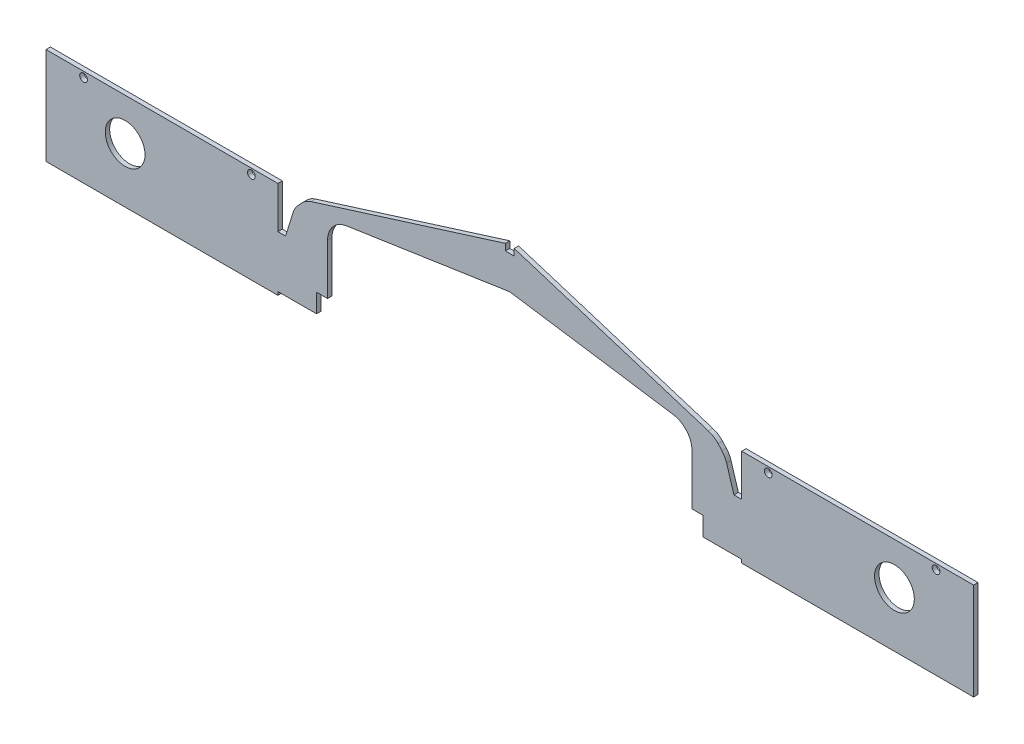
from build123d import *

# Parameters (mm, degrees)
SCHIZZO1_W                   = 420
SCHIZZO1_H                   = 43.9
PIASTRABASE_DEPTH            = 2
SCHIZZO2_R                   = 9
SCHIZZO2_R_2                 = 1.75
FORODESTRO_DEPTH             = 212.153504588
INTAGLIOINFERIORE_DEPTH      = 212.153504588
INTAGLIOSUPERIORE_DEPTH      = 212.153504588
ESTRUSIONE_ESTRUSIONE1_DEPTH = 2
RACCORDO2_R                  = 10
RACCORDO3_R                  = 10
RACCORDO2_OF_SPECCHIA1_R     = 10
RACCORDO3_OF_SPECCHIA1_R     = 10


with BuildPart() as part:
    # Schizzo1 → PiastraBase (new body)
    with BuildSketch(Plane.XY):
        Rectangle(SCHIZZO1_W, SCHIZZO1_H)
    extrude(amount=PIASTRABASE_DEPTH)

    # Schizzo2 → ForoDestro (cut, through all)
    with BuildSketch(Plane(origin=(0, 0, 0), x_dir=(-1, 0, 0), z_dir=(0, 0, -1))):
        with Locations((-174.166666667, 3.05)):
            Circle(SCHIZZO2_R)
        with Locations((-193, 19.45)):
            Circle(SCHIZZO2_R_2)
        with Locations((-117, 19.45)):
            Circle(SCHIZZO2_R_2)
    forodestro = extrude(amount=-FORODESTRO_DEPTH, mode=Mode.SUBTRACT)

    # ForoSinistro: ForoDestro across plane
    add(forodestro.mirror(Plane(origin=(0, 0, 0), x_dir=(0, 0, 1), z_dir=(1, 0, 0))), mode=Mode.SUBTRACT)

    # Schizzo3 → IntaglioInferiore (cut, through all)
    with BuildSketch(Plane(origin=(0, 0, 0), x_dir=(-1, 0, 0), z_dir=(0, 0, -1))):
        Polygon((-105, -21.95), (-105, -20.45), (-87.5, -20.45), (-87.5, -11.95), (-82.5, -11.95), (-82.5, -20.45), (82.5, -20.45), (82.5, -11.95), (87.5, -11.95), (87.5, -20.45), (105, -20.45), (105, -21.95), align=None)
    extrude(amount=-INTAGLIOINFERIORE_DEPTH, mode=Mode.SUBTRACT)

    # Schizzo4 → IntaglioSuperiore (cut, through all)
    with BuildSketch(Plane(origin=(0, 0, 0), x_dir=(-1, 0, 0), z_dir=(0, 0, -1))):
        Polygon((-105, 21.95), (-104.999999109, 3.05), (-82.5, 3.05), (-82.5, -20.45), (82.5, -20.45), (82.5, 3.05), (104.999999109, 3.05), (105, 21.95), align=None)
    extrude(amount=-INTAGLIOSUPERIORE_DEPTH, mode=Mode.SUBTRACT)


with BuildPart() as intagliosuperiore_piece_1:
    # of the separate pieces the step leaves, piece 1, a body of its own (intagliosuperiore_pieces)
    add(part.part.solids().sort_by_distance((-210, 21.95, 0))[0])


with BuildPart() as intagliosuperiore_piece_2:
    # of the separate pieces the step leaves, piece 2, a body of its own (intagliosuperiore_pieces)
    add(part.part.solids().sort_by_distance((210, -21.95, 0))[0])

    # Schizzo5 → Estrusione-Estrusione1 (add)
    with BuildSketch(Plane(origin=(0, 0, 0), x_dir=(-1, 0, 0), z_dir=(0, 0, -1))):
        Polygon((-82.5, 3.05), (-82.5, 19.55), (0, 31.95), (0, 46.95), (-2, 46.95), (-2, 49.95), (-92.5, 21.55), (-97.5, 16.05), (-101.5, 3.05), align=None)
    estrusione_estrusione1 = extrude(amount=-ESTRUSIONE_ESTRUSIONE1_DEPTH)

    # Raccordo2
    raccordo2_edges = [intagliosuperiore_piece_2.edges().sort_by_distance(p)[0] for p in [
        (82.5, 19.55, 1),
    ]]
    fillet(raccordo2_edges, radius=RACCORDO2_R)

    # Raccordo3
    raccordo3_edges = [intagliosuperiore_piece_2.edges().sort_by_distance(p)[0] for p in [
        (92.5, 21.55, 1),
        (97.5, 16.05, 1),
    ]]
    fillet(raccordo3_edges, radius=RACCORDO3_R)

    # Specchia1: Estrusione-Estrusione1 across plane
    add(estrusione_estrusione1.mirror(Plane(origin=(0, 0, 0), x_dir=(0, 0, 1), z_dir=(1, 0, 0))))

    # Raccordo2 of Specchia1
    raccordo2_of_specchia1_edges = [intagliosuperiore_piece_2.edges().sort_by_distance(p)[0] for p in [
        (-82.5, 19.55, 1),
    ]]
    fillet(raccordo2_of_specchia1_edges, radius=RACCORDO2_OF_SPECCHIA1_R)

    # Raccordo3 of Specchia1
    raccordo3_of_specchia1_edges = [intagliosuperiore_piece_2.edges().sort_by_distance(p)[0] for p in [
        (-92.5, 21.55, 1),
        (-97.5, 16.05, 1),
    ]]
    fillet(raccordo3_of_specchia1_edges, radius=RACCORDO3_OF_SPECCHIA1_R)

    # Abbina1: union IntaglioSuperiore piece 1
    add(intagliosuperiore_piece_1.part)


solid = intagliosuperiore_piece_2.part
